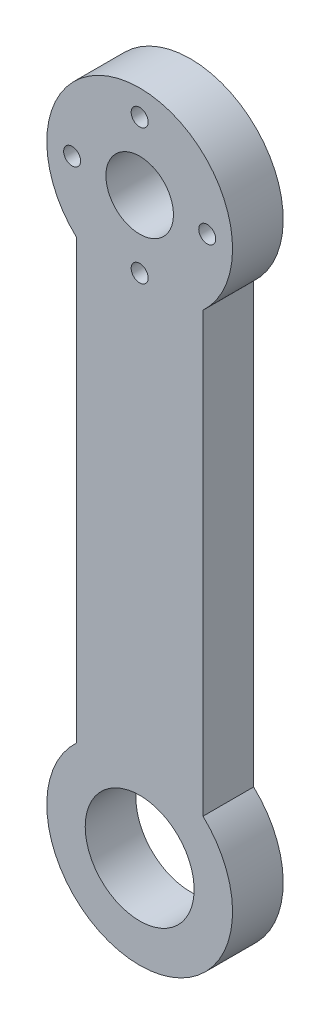
from build123d import *

# Parameters (mm, degrees)
ESQUISSE1_W             = 15
ESQUISSE1_H             = 83
BOSS_EXTRU_1_DEPTH      = 6
ESQUISSE2_R             = 11
BOSS_EXTRU_2_DEPTH      = 6
ESQUISSE4_R             = 4
ESQUISSE4_R_2           = 1.005
ESQUISSE4_R_3           = 6.45
ENL_V_MAT_EXTRU_2_DEPTH = 10
ESQUISSE5_R             = 2
ENL_V_MAT_EXTRU_3_DEPTH = 4


with BuildPart() as part:
    # Esquisse1 → Boss.-Extru.1 (new body)
    with BuildSketch(Plane.XY):
        with Locations((7.5, 41.5)):
            Rectangle(ESQUISSE1_W, ESQUISSE1_H)
    extrude(amount=BOSS_EXTRU_1_DEPTH)

    # Esquisse2 → Boss.-Extru.2 (add)
    with BuildSketch(Plane.XY.offset(6)):
        with Locations((7.5, 7.5)):
            Circle(ESQUISSE2_R)
        with Locations((7.5, 75.5)):
            Circle(ESQUISSE2_R)
    extrude(amount=-BOSS_EXTRU_2_DEPTH)

    # Esquisse4 → Enlèv. mat.-Extru.2 (cut)
    with BuildSketch(Plane(origin=(0, 0, 0), x_dir=(-1, 0, 0), z_dir=(0, 0, -1))):
        with Locations((-7.5, 75.5)):
            Circle(ESQUISSE4_R)
        with Locations((-7.5, 67.5)):
            Circle(ESQUISSE4_R_2)
        with Locations((-15.5, 75.5)):
            Circle(ESQUISSE4_R_2)
        with Locations((-7.5, 83.5)):
            Circle(ESQUISSE4_R_2)
        with Locations((0.5, 75.5)):
            Circle(ESQUISSE4_R_2)
        with Locations((-7.5, 7.5)):
            Circle(ESQUISSE4_R_3)
    extrude(amount=-ENL_V_MAT_EXTRU_2_DEPTH, mode=Mode.SUBTRACT)

    # Esquisse5 → Enlèv. mat.-Extru.3 (cut)
    with BuildSketch(Plane(origin=(0, 0, 0), x_dir=(-1, 0, 0), z_dir=(0, 0, -1))):
        with Locations((-15.5, 75.5)):
            Circle(ESQUISSE5_R)
        with Locations((-7.5, 83.5)):
            Circle(ESQUISSE5_R)
        with Locations((0.5, 75.5)):
            Circle(ESQUISSE5_R)
        with Locations((-7.5, 67.5)):
            Circle(ESQUISSE5_R)
    extrude(amount=-ENL_V_MAT_EXTRU_3_DEPTH, mode=Mode.SUBTRACT)


solid = part.part
